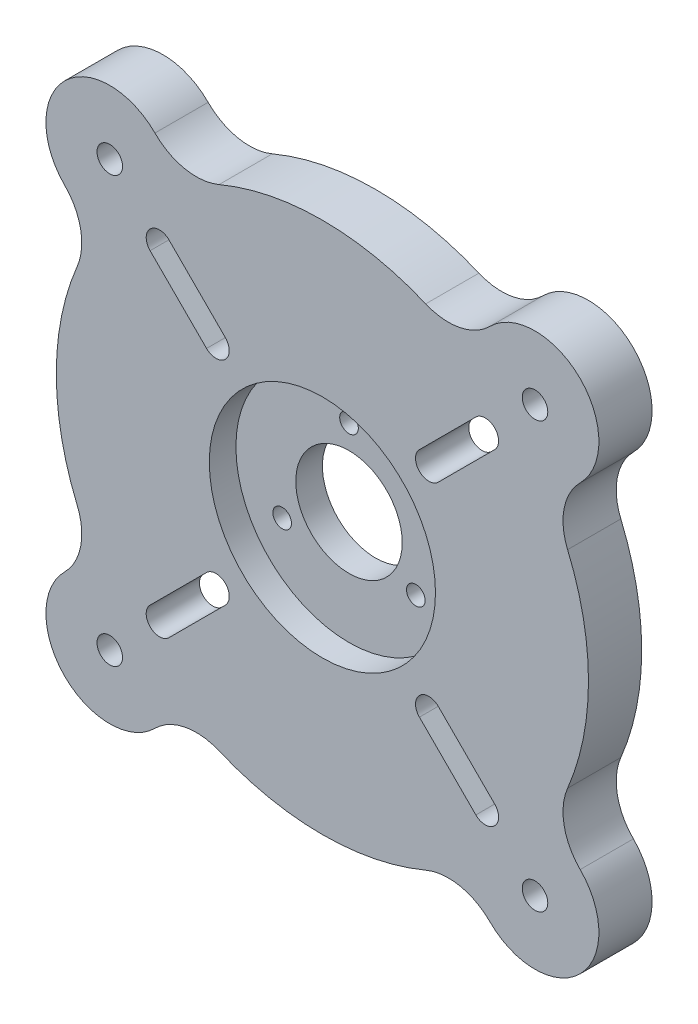
from build123d import *

# Parameters (mm, degrees)
SKETCH1_R           = 2.4
BOSS_EXTRUDE1_DEPTH = 10
SKETCH2_R           = 21.25
CUT_EXTRUDE1_DEPTH  = 5
SKETCH2_3_R         = 1.75
CUT_EXTRUDE2_DEPTH  = 75.1479844
SKETCH3_R           = 10
CUT_EXTRUDE3_DEPTH  = 74.640502379


with BuildPart() as part:
    # Sketch1 → Boss-Extrude1 (new body)
    with BuildSketch(Plane.XY):
        with BuildLine():
            ThreePointArc((46.077281732, -19.413503243), (50, 0), (46.077281732, 19.413503243))
            ThreePointArc((46.077281732, 19.413503243), (45.41900176, 25.799706685), (48.436814511, 31.466251763))
            ThreePointArc((48.436814511, 31.466251763), (48.436814511, 48.436814511), (31.466251763, 48.436814511))
            ThreePointArc((31.466251763, 48.436814511), (25.799706685, 45.41900176), (19.413503243, 46.077281732))
            ThreePointArc((19.413503243, 46.077281732), (0, 50), (-19.413503243, 46.077281732))
            ThreePointArc((-19.413503243, 46.077281732), (-25.799706685, 45.41900176), (-31.466251763, 48.436814511))
            ThreePointArc((-31.466251763, 48.436814511), (-48.436814511, 48.436814511), (-48.436814511, 31.466251763))
            ThreePointArc((-48.436814511, 31.466251763), (-45.41900176, 25.799706685), (-46.077281732, 19.413503243))
            ThreePointArc((-46.077281732, 19.413503243), (-50, 0), (-46.077281732, -19.413503243))
            ThreePointArc((-46.077281732, -19.413503243), (-45.41900176, -25.799706685), (-48.436814511, -31.466251763))
            ThreePointArc((-48.436814511, -31.466251763), (-48.436814511, -48.436814511), (-31.466251763, -48.436814511))
            ThreePointArc((-31.466251763, -48.436814511), (-25.799706685, -45.41900176), (-19.413503243, -46.077281732))
            ThreePointArc((-19.413503243, -46.077281732), (0, -50), (19.413503243, -46.077281732))
            ThreePointArc((19.413503243, -46.077281732), (25.799706685, -45.41900176), (31.466251763, -48.436814511))
            ThreePointArc((31.466251763, -48.436814511), (48.436814511, -48.436814511), (48.436814511, -31.466251763))
            ThreePointArc((48.436814511, -31.466251763), (45.41900176, -25.799706685), (46.077281732, -19.413503243))
        make_face()
        with BuildLine():
            ThreePointArc((-21.767766953, -18.232233047), (-18.232233047, -18.232233047), (-18.232233047, -21.767766953))
            Line((-18.232233047, -21.767766953), (-28.838834765, -32.374368671))
            ThreePointArc((-28.838834765, -32.374368671), (-32.374368671, -32.374368671), (-32.374368671, -28.838834765))
            Line((-32.374368671, -28.838834765), (-21.767766953, -18.232233047))
        make_face(mode=Mode.SUBTRACT)
        with BuildLine():
            ThreePointArc((18.232233047, -21.767766953), (18.232233047, -18.232233047), (21.767766953, -18.232233047))
            Line((21.767766953, -18.232233047), (32.374368671, -28.838834765))
            ThreePointArc((32.374368671, -28.838834765), (32.374368671, -32.374368671), (28.838834765, -32.374368671))
            Line((28.838834765, -32.374368671), (18.232233047, -21.767766953))
        make_face(mode=Mode.SUBTRACT)
        with BuildLine():
            ThreePointArc((-18.232233047, 21.767766953), (-18.232233047, 18.232233047), (-21.767766953, 18.232233047))
            Line((-21.767766953, 18.232233047), (-32.374368671, 28.838834765))
            ThreePointArc((-32.374368671, 28.838834765), (-32.374368671, 32.374368671), (-28.838834765, 32.374368671))
            Line((-28.838834765, 32.374368671), (-18.232233047, 21.767766953))
        make_face(mode=Mode.SUBTRACT)
        with BuildLine():
            ThreePointArc((21.767766953, 18.232233047), (18.232233047, 18.232233047), (18.232233047, 21.767766953))
            Line((18.232233047, 21.767766953), (28.838834765, 32.374368671))
            ThreePointArc((28.838834765, 32.374368671), (32.374368671, 32.374368671), (32.374368671, 28.838834765))
            Line((32.374368671, 28.838834765), (21.767766953, 18.232233047))
        make_face(mode=Mode.SUBTRACT)
        with Locations((39.951533137, -39.951533137)):
            Circle(SKETCH1_R, mode=Mode.SUBTRACT)
        with Locations((-39.951533137, -39.951533137)):
            Circle(SKETCH1_R, mode=Mode.SUBTRACT)
        with Locations((-39.951533137, 39.951533137)):
            Circle(SKETCH1_R, mode=Mode.SUBTRACT)
        with Locations((39.951533137, 39.951533137)):
            Circle(SKETCH1_R, mode=Mode.SUBTRACT)
    extrude(amount=BOSS_EXTRUDE1_DEPTH)

    # Sketch2 → Cut-Extrude1 (cut)
    with BuildSketch(Plane.XY.offset(10)):
        Circle(SKETCH2_R)
    extrude(amount=-CUT_EXTRUDE1_DEPTH, mode=Mode.SUBTRACT)

    # Sketch2<3> → Cut-Extrude2 (cut, through all)
    with BuildSketch(Plane.XY.offset(10)):
        with Locations((0, 14.5)):
            Circle(SKETCH2_3_R)
        with Locations((12.557368355, -7.25)):
            Circle(SKETCH2_3_R)
        with Locations((-12.557368355, -7.25)):
            Circle(SKETCH2_3_R)
    extrude(amount=-CUT_EXTRUDE2_DEPTH, mode=Mode.SUBTRACT)

    # Sketch3 → Cut-Extrude3 (cut, through all)
    with BuildSketch(Plane.XY.offset(5)):
        Circle(SKETCH3_R)
    extrude(amount=-CUT_EXTRUDE3_DEPTH, mode=Mode.SUBTRACT)


solid = part.part
